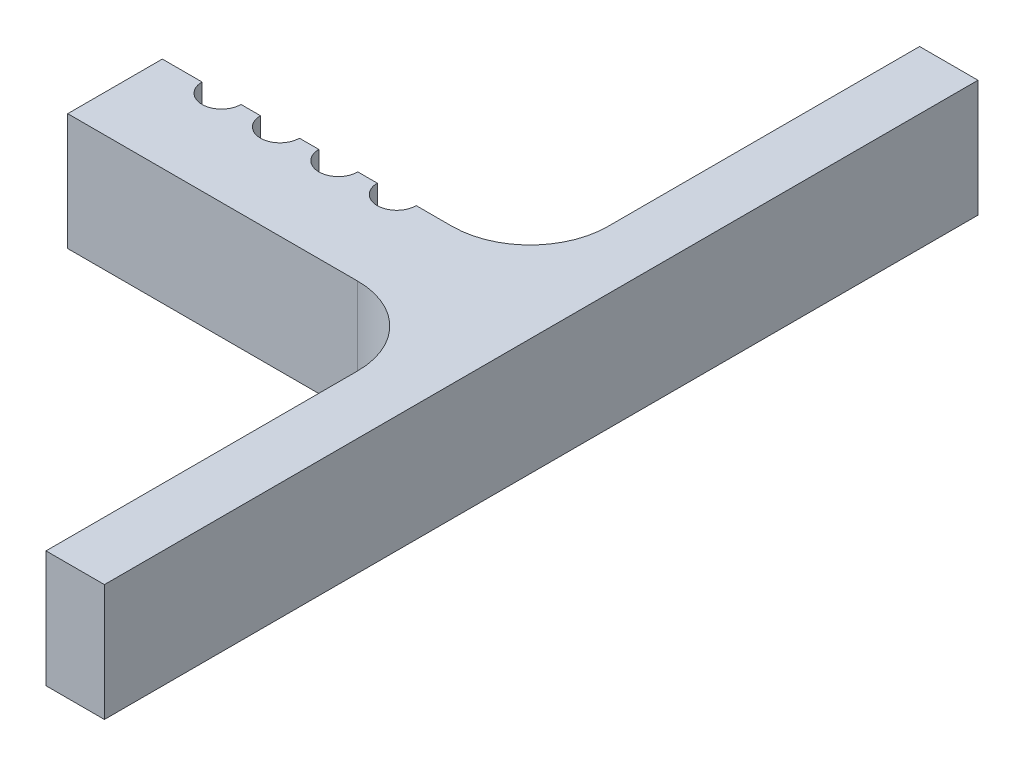
from build123d import *

# Parameters (mm, degrees)
SKETCH1_W           = 4.721281475
SKETCH1_H           = 1.214825
BOSS_EXTRUDE1_DEPTH = 1.5
FILLET1_R           = 1
FILLET2_R           = 1
CUT_EXTRUDE1_DEPTH  = 2
LPATTERN1_COUNT     = 4
LPATTERN1_PITCH     = 0.75


with BuildPart() as part:
    # Sketch1 → Boss-Extrude1 (new body)
    with BuildSketch(Plane(origin=(0, 0, 0), x_dir=(1, 0, 0), z_dir=(0, 1, 0))):
        Polygon((-42.085271319, 4.006512849), (-41.335271319, 4.006512849), (-41.335271319, 15.221337849), (-42.085271319, 15.221337849), (-42.085271319, 10.221337849), (-42.085271319, 9.006512849), align=None)
        with Locations((-44.445912057, 9.613925349)):
            Rectangle(SKETCH1_W, SKETCH1_H)
    extrude(amount=BOSS_EXTRUDE1_DEPTH)

    # Fillet1
    fillet1_edges = [part.edges().sort_by_distance(p)[0] for p in [
        (-42.085271319, 0.75, -10.221337849),
    ]]
    fillet(fillet1_edges, radius=FILLET1_R)

    # Fillet2
    fillet2_edges = [part.edges().sort_by_distance(p)[0] for p in [
        (-42.085271319, 0.75, -9.006512849),
    ]]
    fillet(fillet2_edges, radius=FILLET2_R)

    # Sketch2 → Cut-Extrude1 (cut)
    with BuildSketch(Plane(origin=(0, 1.5, 0), x_dir=(1, 0, 0), z_dir=(0, 1, 0))):
        with BuildLine():
            ThreePointArc((-45.796552794, 10.221337849), (-46.046552794, 10.471337849), (-46.296552794, 10.221337849))
            Line((-46.296552794, 10.221337849), (-46.046552794, 10.221337849))
            Line((-46.046552794, 10.221337849), (-45.796552794, 10.221337849))
        make_face()
        with BuildLine():
            Line((-46.046552794, 10.221337849), (-46.296552794, 10.221337849))
            ThreePointArc((-46.296552794, 10.221337849), (-46.046552794, 9.971337849), (-45.796552794, 10.221337849))
            Line((-45.796552794, 10.221337849), (-46.046552794, 10.221337849))
        make_face()
    cut_extrude1 = extrude(amount=-CUT_EXTRUDE1_DEPTH, mode=Mode.SUBTRACT)

    # LPattern1: Cut-Extrude1 ×4
    with Locations(*[(i * LPATTERN1_PITCH, 0, 0) for i in range(1, LPATTERN1_COUNT)]):
        add(cut_extrude1, mode=Mode.SUBTRACT)


solid = part.part
